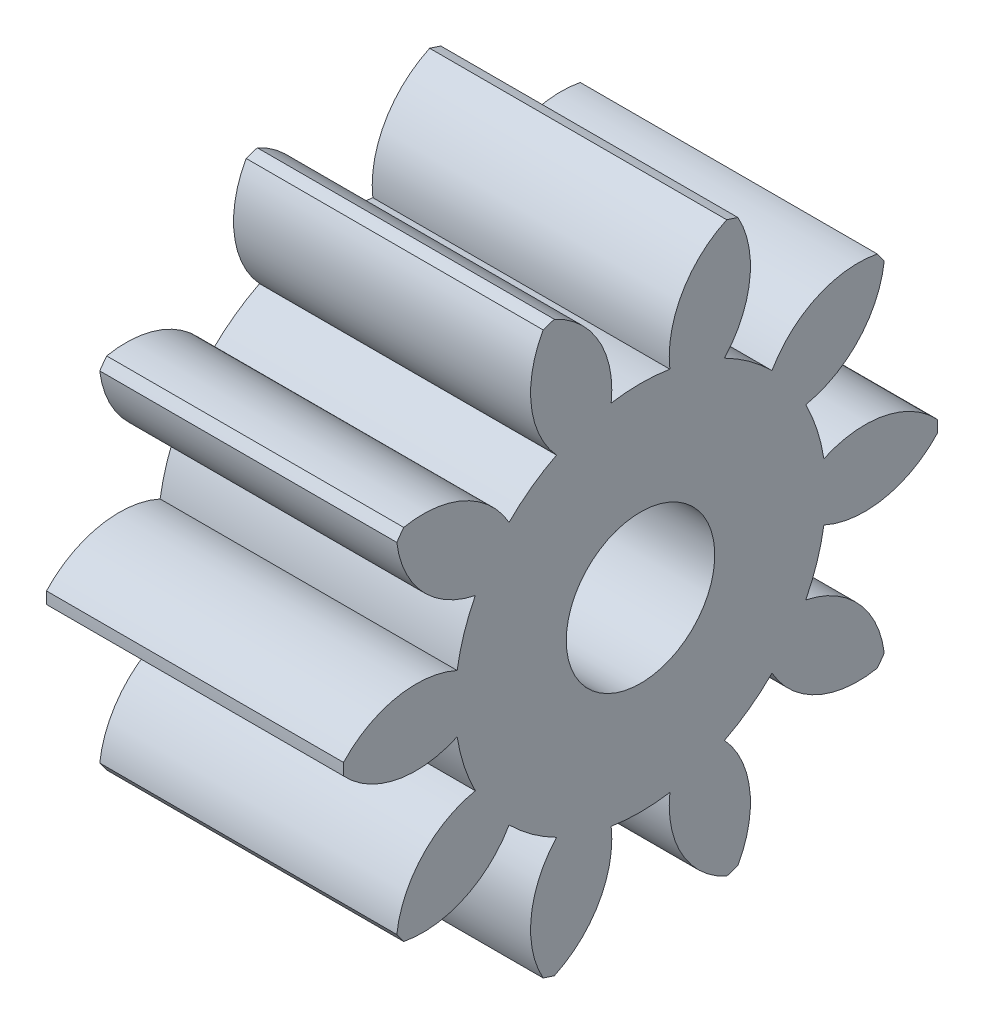
from build123d import *

# Parameters (mm, degrees)
BASPROSKE_W     = 6
BASPROSKE_H     = 6
TOOTHCUT_DEPTH  = 11.392304845
TEETHCUTS_COUNT = 10
TEETHCUTS_ANGLE = 324
BORSKE_R        = 1.5
BORE_DEPTH      = 50.0000508


with BuildPart() as part:
    # BasProSke → Base-Revolve (revolve)
    with BuildSketch(Plane(origin=(0, 0, 0), x_dir=(1, 0, 0), z_dir=(0, 1, 0)), mode=Mode.PRIVATE) as base_revolve_sk:
        with Locations((3, 3)):
            Rectangle(BASPROSKE_W, BASPROSKE_H)
    revolve(base_revolve_sk.sketch.rotate(Axis((-10, 0, 0), (1, 0, 0)), 180), axis=Axis((-10, 0, 0), (1, 0, 0)))

    # TooCutSke → ToothCut (cut, through all)
    with BuildSketch(Plane(origin=(0, 0, 0), x_dir=(0, 0, -1), z_dir=(1, 0, 0))):
        with BuildLine():
            ThreePointArc((0.59278292, 3.701838653), (0, 3.749), (-0.59278292, 3.701838653))
            ThreePointArc((-0.59278292, 3.701838653), (-0.846593509, 4.924114224), (-1.775771316, 5.757784417))
            ThreePointArc((-1.775771316, 5.757784417), (0, 6.0254), (1.775771316, 5.757784417))
            ThreePointArc((1.775771316, 5.757784417), (0.846593509, 4.924114224), (0.59278292, 3.701838653))
        make_face()
    toothcut = extrude(amount=TOOTHCUT_DEPTH, mode=Mode.SUBTRACT)

    # TeethCuts: ToothCut ×10 about axis
    teethcuts_axis = Axis((-10, 0, 0), (1, 0, 0))
    for i in range(1, TEETHCUTS_COUNT):
        add(toothcut.rotate(teethcuts_axis, i * TEETHCUTS_ANGLE / (TEETHCUTS_COUNT - 1)), mode=Mode.SUBTRACT)

    # BorSke → Bore (cut, symmetric)
    with BuildSketch(Plane(origin=(0, 0, 0), x_dir=(0, 0, -1), z_dir=(1, 0, 0))):
        with Locations(Location((0, 0, 0), (0, 0, 180))):
            Circle(BORSKE_R)
    extrude(amount=BORE_DEPTH, both=True, mode=Mode.SUBTRACT)


solid = part.part
